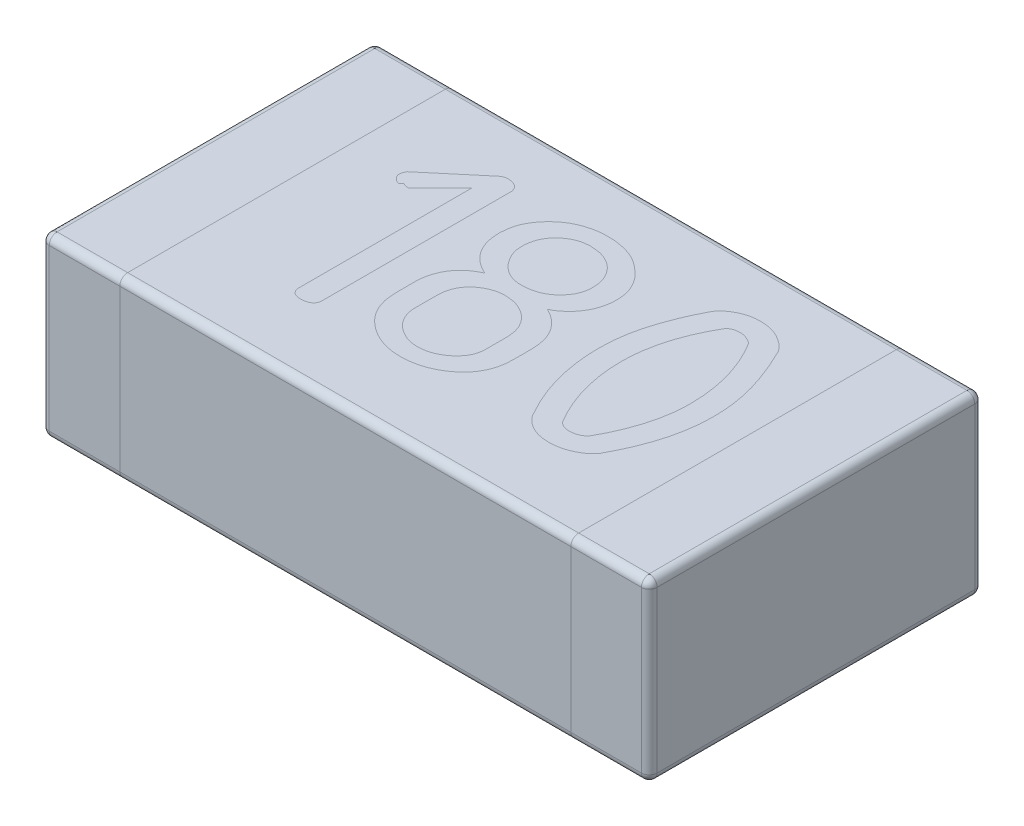
from build123d import *

# Parameters (mm, degrees)
BOSS_EXTRUDE1_DEPTH = 0.225
FILLET2_R           = 0.02


with BuildPart() as part:
    # Sketch1 → Boss-Extrude1 (new, symmetric)
    with BuildSketch(Plane(origin=(0, 0, 0), x_dir=(1, 0, 0), z_dir=(0, 1, 0))):
        with BuildLine():
            Line((-0.755, -0.425), (0.755, -0.425))
            ThreePointArc((0.755, -0.425), (0.769142136, -0.419142136), (0.775, -0.405))
            Line((0.775, -0.405), (0.775, 0.405))
            ThreePointArc((0.775, 0.405), (0.769142136, 0.419142136), (0.755, 0.425))
            Line((0.755, 0.425), (-0.755, 0.425))
            ThreePointArc((-0.755, 0.425), (-0.769142136, 0.419142136), (-0.775, 0.405))
            Line((-0.775, 0.405), (-0.775, -0.405))
            ThreePointArc((-0.775, -0.405), (-0.769142136, -0.419142136), (-0.755, -0.425))
        make_face()
    extrude(amount=BOSS_EXTRUDE1_DEPTH, both=True)

    # Fillet2
    fillet2_edges = [part.edges().sort_by_distance(p)[0] for p in [
        (0.769142136, 0.225, 0.419142136),
        (0, -0.225, 0.425),
        (0, 0.225, 0.425),
        (0, 0.225, -0.425),
        (-0.769142136, -0.225, 0.419142136),
        (0, 0.225, -0.425),
        (0, 0.225, 0.425),
        (0, -0.225, 0.425),
        (0.775, 0.225, 0),
        (0, -0.225, 0.425),
        (0, -0.225, -0.425),
        (0, -0.225, -0.425),
        (0.769142136, 0.225, -0.419142136),
        (0, 0.225, -0.425),
        (-0.769142136, 0.225, -0.419142136),
        (-0.775, 0.225, 0),
        (-0.769142136, 0.225, 0.419142136),
        (0, 0.225, 0.425),
        (-0.775, -0.225, 0),
        (-0.769142136, -0.225, -0.419142136),
        (0, -0.225, -0.425),
        (0.769142136, -0.225, -0.419142136),
        (0.775, -0.225, 0),
        (0.769142136, -0.225, 0.419142136),
    ]]
    fillet(fillet2_edges, radius=FILLET2_R)


solid = part.part
